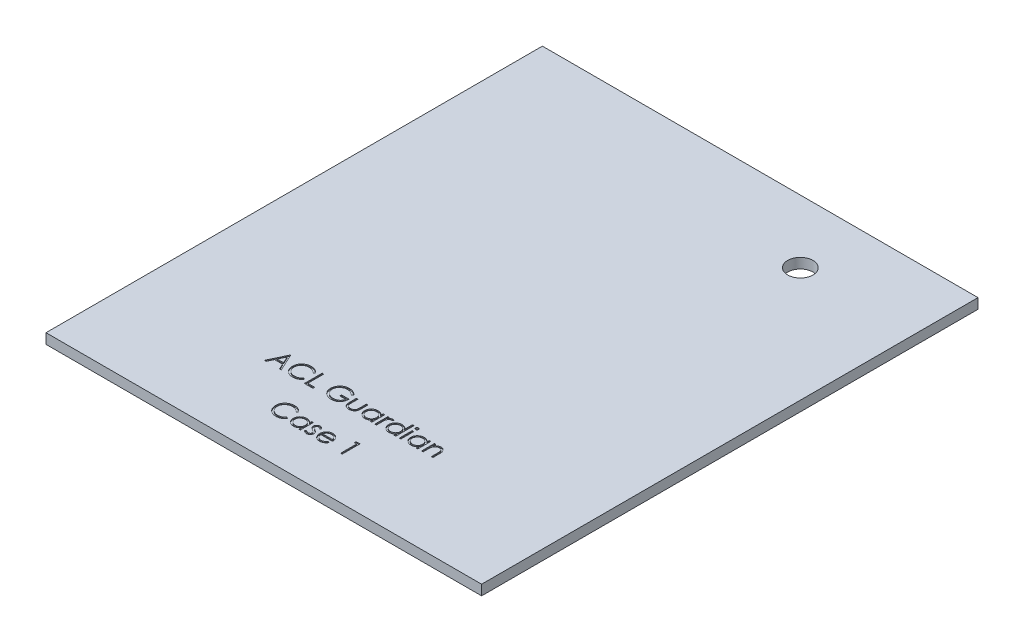
from build123d import *

# Parameters (mm, degrees)
SKETCH1_W           = 86
SKETCH1_H           = 2
BOSS_EXTRUDE1_DEPTH = 98
SKETCH2_R           = 2.5
CUT_EXTRUDE1_DEPTH  = 98
SKETCH3_W           = 0.314102564
SKETCH3_H           = 2.557692308
CUT_EXTRUDE2_DEPTH  = 0.2


with BuildPart() as part:
    # Sketch1 → Boss-Extrude1 (new body)
    with BuildSketch(Plane.XY):
        with Locations((43, -1)):
            Rectangle(SKETCH1_W, SKETCH1_H)
    extrude(amount=BOSS_EXTRUDE1_DEPTH)

    # Sketch2 → Cut-Extrude1 (cut)
    with BuildSketch(Plane(origin=(0, 0, 0), x_dir=(1, 0, 0), z_dir=(0, 1, 0))):
        with Locations(Location((63.346319972, -12.421838095, 0), (0, 0, 270))):
            Circle(SKETCH2_R)
    extrude(amount=-CUT_EXTRUDE1_DEPTH, mode=Mode.SUBTRACT)

    # Sketch3 → Cut-Extrude2 (cut)
    # profile 1 of 17: a face of its own
    with BuildSketch(Plane(origin=(0, 0, 0), x_dir=(1, 0, 0), z_dir=(0, 1, 0))):
        Polygon((27.990384615, -77.660758434), (29.605769231, -81.160758434), (29.264322917, -81.160758434), (28.746895032, -80.038963562), (27.16025641, -80.038963562), (26.62880609, -81.160758434), (26.28525641, -81.160758434), (27.945512821, -77.660758434), align=None)
        Polygon((27.964443109, -78.343651062), (27.331330128, -79.679989203), (28.581430288, -79.679989203), align=None, mode=Mode.SUBTRACT)
    # profile 2 of 17: a face of its own
    with BuildSketch(Plane(origin=(0, 0, 0), x_dir=(1, 0, 0), z_dir=(0, 1, 0))):
        with BuildLine():
            Line((33.46474359, -78.302985998), (33.189903846, -78.513322537))
            add(Edge.make_bspline(
                [(33.189903846, -78.513322537), (33.170297958, -78.489956567), (33.131350511, -78.443539651), (33.068691308, -78.378360107), (33.003389666, -78.317294845), (32.935470544, -78.260052966), (32.863711425, -78.2086362), (32.789850626, -78.160365097), (32.712652581, -78.117097359), (32.605900846, -78.064634373), (32.466252998, -78.009888218), (32.290458159, -77.963984987), (32.10694706, -77.934763811), (31.981749461, -77.931598969), (31.91806891, -77.929989203)],
                knots=[0, 0, 0, 0, 0.757959112, 1.505699292, 2.245454638, 2.979532153, 3.711538275, 4.438200793, 5.171680507, 5.909471876, 7.393775596, 8.890124382, 10.418191784, 12, 12, 12, 12], degree=3))
            add(Edge.make_bspline(
                [(31.91806891, -77.929989203), (31.882985611, -77.930393166), (31.813144618, -77.931197342), (31.709496145, -77.941806467), (31.607783094, -77.956717677), (31.508071627, -77.978843), (31.410488669, -78.006815619), (31.314396267, -78.040241033), (31.221185667, -78.081595873), (31.129567429, -78.127304133), (31.041788218, -78.178931578), (30.95873317, -78.23524493), (30.880705202, -78.295614026), (30.80764259, -78.360265132), (30.739470642, -78.428907093), (30.676683331, -78.502271435), (30.619497921, -78.580123608), (30.566780896, -78.661437016), (30.519568162, -78.745974807), (30.480038283, -78.834049878), (30.445033161, -78.924153981), (30.417333918, -79.017305142), (30.395409401, -79.112847907), (30.380281738, -79.211038695), (30.369793267, -79.311672375), (30.36899309, -79.379881688), (30.368589744, -79.414264043)],
                knots=[0, 0, 0, 0, 1.054917814, 2.100044995, 3.131103042, 4.146048494, 5.169673617, 6.183595914, 7.203665975, 8.234915748, 9.262203917, 10.264457458, 11.251630812, 12.227803204, 13.197192746, 14.159520551, 15.12972552, 16.100847026, 17.073214652, 18.039054194, 19.002613845, 19.979014051, 20.95965708, 21.949030935, 22.966165397, 24, 24, 24, 24], degree=3))
            add(Edge.make_bspline(
                [(30.368589744, -79.414264043), (30.369851563, -79.465995363), (30.372328977, -79.567562948), (30.394377311, -79.716333558), (30.427882402, -79.858854232), (30.478097979, -79.994234075), (30.54001703, -80.124142433), (30.618257641, -80.246381286), (30.708874179, -80.36279785), (30.813148598, -80.470640798), (30.927554414, -80.569154524), (31.050302326, -80.655905105), (31.181086613, -80.728219988), (31.318463244, -80.788395934), (31.463489358, -80.834652662), (31.61590416, -80.867216785), (31.775376155, -80.888458966), (31.884345555, -80.890492654), (31.939803686, -80.891527665)],
                knots=[0, 0, 0, 0, 1.029171465, 2.020641659, 2.987623507, 3.938342917, 4.889210282, 5.84687017, 6.821220943, 7.821438502, 8.827599549, 9.822697543, 10.807740252, 11.797342354, 12.80366471, 13.83203677, 14.896651826, 16, 16, 16, 16], degree=3))
            add(Edge.make_bspline(
                [(31.939803686, -80.891527665), (32.000906375, -80.889838885), (32.121171084, -80.886514963), (32.29753911, -80.858355713), (32.466374876, -80.812697796), (32.627687462, -80.748799873), (32.781022109, -80.665734585), (32.926618769, -80.565036708), (33.064600339, -80.445748375), (33.147571622, -80.354665247), (33.189903846, -80.308194332)],
                knots=[0, 0, 0, 0, 1.028121516, 2.023589091, 2.998037872, 3.967518031, 4.937445131, 5.927275754, 6.942489185, 8, 8, 8, 8], degree=3))
            Line((33.189903846, -80.308194332), (33.46474359, -80.516427505))
            add(Edge.make_bspline(
                [(33.46474359, -80.516427505), (33.44262548, -80.544965957), (33.398495205, -80.601906163), (33.327037188, -80.682177873), (33.25175989, -80.757681908), (33.17210418, -80.827809529), (33.088986389, -80.893963995), (33.000914076, -80.954265826), (32.909045044, -81.00955671), (32.813690565, -81.060183635), (32.714951952, -81.105100882), (32.612947517, -81.14355465), (32.508116942, -81.176679539), (32.400455433, -81.203931476), (32.289739676, -81.22520256), (32.176369202, -81.239422235), (32.060099327, -81.249164149), (31.981657906, -81.250052065), (31.941907051, -81.250502024)],
                knots=[0, 0, 0, 0, 0.986787822, 1.968848986, 2.935600012, 3.899624008, 4.868462664, 5.837806735, 6.815139263, 7.798259679, 8.787526145, 9.778297419, 10.776456485, 11.791383307, 12.812564526, 13.85620153, 14.913611965, 16, 16, 16, 16], degree=3))
            add(Edge.make_bspline(
                [(31.941907051, -81.250502024), (31.904263384, -81.250240031), (31.829827694, -81.249721973), (31.719928943, -81.241329806), (31.612939362, -81.229880069), (31.509164736, -81.212639938), (31.408038761, -81.192295598), (31.310478176, -81.165024341), (31.215522966, -81.134475175), (31.123554625, -81.098570188), (31.034494925, -81.058054006), (30.948631114, -81.012262447), (30.866002682, -80.961580582), (30.785797261, -80.907125572), (30.709199677, -80.84714827), (30.635546152, -80.782481635), (30.564423676, -80.713343624), (30.520420991, -80.663488771), (30.498297276, -80.638422697)],
                knots=[0, 0, 0, 0, 1.114604814, 2.203992996, 3.262667896, 4.300477797, 5.318619304, 6.316056647, 7.298880507, 8.271930387, 9.238335007, 10.195173496, 11.151986948, 12.108099108, 13.064862484, 14.031167946, 15.010108607, 16, 16, 16, 16], degree=3))
            add(Edge.make_bspline(
                [(30.498297276, -80.638422697), (30.462861632, -80.594881508), (30.392418155, -80.508324798), (30.302292472, -80.368038816), (30.225144917, -80.221570608), (30.162768996, -80.068150679), (30.114006263, -79.908123291), (30.080225068, -79.741407777), (30.058273463, -79.568159835), (30.055763174, -79.450323046), (30.054487179, -79.390425902)],
                knots=[0, 0, 0, 0, 0.994628077, 1.977248131, 2.950237994, 3.925870899, 4.908910175, 5.911660606, 6.938484602, 8, 8, 8, 8], degree=3))
            add(Edge.make_bspline(
                [(30.054487179, -79.390425902), (30.056042373, -79.327470449), (30.059102119, -79.203609524), (30.085097915, -79.021835571), (30.126916711, -78.847684172), (30.1863136, -78.681480427), (30.261618951, -78.522350147), (30.354645565, -78.371508942), (30.464312707, -78.227992143), (30.589760275, -78.093977391), (30.72732761, -77.971438039), (30.874646424, -77.863631835), (31.031428371, -77.773914319), (31.195946222, -77.698918156), (31.369431904, -77.641273693), (31.551515273, -77.600920507), (31.741854188, -77.57580339), (31.871716614, -77.572628182), (31.937700321, -77.571014844)],
                knots=[0, 0, 0, 0, 1.032925535, 2.032216505, 3.007276963, 3.968222605, 4.92396291, 5.891752235, 6.871517503, 7.883894988, 8.900124299, 9.891468569, 10.874487609, 11.85992873, 12.854644235, 13.869047385, 14.917252991, 16, 16, 16, 16], degree=3))
            add(Edge.make_bspline(
                [(31.937700321, -77.571014844), (31.977914792, -77.571496983), (32.05751529, -77.572451327), (32.175267942, -77.581757469), (32.289910269, -77.597271075), (32.401521251, -77.618387145), (32.510643867, -77.644594466), (32.616444108, -77.678734765), (32.719542795, -77.717771296), (32.819289703, -77.762729762), (32.915206253, -77.813196503), (33.007262572, -77.868612127), (33.094727431, -77.928907932), (33.178216279, -77.993571108), (33.25633249, -78.063969667), (33.331293969, -78.138167263), (33.400555047, -78.218301087), (33.443308242, -78.274706021), (33.46474359, -78.302985998)],
                knots=[0, 0, 0, 0, 1.096760587, 2.17092713, 3.219439832, 4.250915756, 5.268269357, 6.278326846, 7.281116186, 8.274029601, 9.260640565, 10.235837813, 11.203064059, 12.156899882, 13.114053108, 14.069676657, 15.032185724, 16, 16, 16, 16], degree=3))
        make_face()
    # profile 3 of 17: a face of its own
    with BuildSketch(Plane(origin=(0, 0, 0), x_dir=(1, 0, 0), z_dir=(0, 1, 0))):
        Polygon((34.182692308, -77.660758434), (34.496794872, -77.660758434), (34.496794872, -80.801784075), (35.842948718, -80.801784075), (35.842948718, -81.160758434), (34.182692308, -81.160758434), align=None)
    # profile 4 of 17: a face of its own
    with BuildSketch(Plane(origin=(0, 0, 0), x_dir=(1, 0, 0), z_dir=(0, 1, 0))):
        with BuildLine():
            Line((41.048076923, -78.258114203), (40.778846154, -78.513322537))
            add(Edge.make_bspline(
                [(40.778846154, -78.513322537), (40.730127266, -78.467491674), (40.633851219, -78.376922811), (40.476890977, -78.259411816), (40.313127343, -78.158745715), (40.143414846, -78.076839479), (39.971956292, -78.011486719), (39.801027516, -77.964958578), (39.632381814, -77.935286041), (39.520214596, -77.931737672), (39.46494391, -77.929989203)],
                knots=[0, 0, 0, 0, 1.08915593, 2.152340314, 3.188132944, 4.216796309, 5.218260357, 6.173443236, 7.099959455, 8, 8, 8, 8], degree=3))
            add(Edge.make_bspline(
                [(39.46494391, -77.929989203), (39.43102921, -77.930402809), (39.36328777, -77.931228948), (39.262665826, -77.941773164), (39.163099189, -77.956938028), (39.064775814, -77.978879905), (38.967504528, -78.006688965), (38.871623635, -78.041474428), (38.776954281, -78.082029672), (38.6843882, -78.128892146), (38.594647696, -78.180371993), (38.50989086, -78.237420533), (38.429577461, -78.298209323), (38.355217036, -78.364260302), (38.286381849, -78.434975168), (38.221433478, -78.509038474), (38.162656182, -78.588473692), (38.109565017, -78.671819318), (38.062203398, -78.757611508), (38.020394745, -78.845024497), (37.985297657, -78.933768352), (37.957528201, -79.023954429), (37.934617547, -79.114885019), (37.91849994, -79.20718974), (37.909413218, -79.300967425), (37.907841438, -79.363764684), (37.907051282, -79.395333755)],
                knots=[0, 0, 0, 0, 1.02818874, 2.053710826, 3.065248034, 4.081641283, 5.106893873, 6.131558223, 7.173050175, 8.228653731, 9.27666206, 10.308777013, 11.325269123, 12.329503258, 13.32196095, 14.316845687, 15.314881793, 16.315733098, 17.311955233, 18.285320748, 19.252783886, 20.203351036, 21.145449891, 22.095197417, 23.042428769, 24, 24, 24, 24], degree=3))
            add(Edge.make_bspline(
                [(37.907051282, -79.395333755), (37.907807, -79.427604572), (37.909316373, -79.492058085), (37.918976693, -79.588252158), (37.936904933, -79.68301756), (37.960872642, -79.776665694), (37.990853458, -79.869356941), (38.028226124, -79.960689451), (38.072491724, -80.050659843), (38.123728276, -80.138457459), (38.17991448, -80.223980483), (38.242857561, -80.304540005), (38.309718144, -80.381208782), (38.382932044, -80.452284546), (38.460151586, -80.519668442), (38.543683862, -80.581503964), (38.631886323, -80.638982187), (38.724893535, -80.691378706), (38.821696317, -80.738187242), (38.92095307, -80.779811138), (39.022980886, -80.814090476), (39.127243576, -80.84202858), (39.233616847, -80.864928877), (39.34264065, -80.879661357), (39.453513358, -80.890352188), (39.52825199, -80.891133858), (39.565905449, -80.891527665)],
                knots=[0, 0, 0, 0, 0.93586088, 1.869166235, 2.799637598, 3.729985548, 4.670839027, 5.622275134, 6.589130586, 7.576015415, 8.568469353, 9.55398029, 10.53834874, 11.515998671, 12.510579167, 13.508179873, 14.527009472, 15.561807829, 16.601455013, 17.643573243, 18.680854198, 19.719860599, 20.772568776, 21.833555941, 22.908541556, 24, 24, 24, 24], degree=3))
            add(Edge.make_bspline(
                [(39.565905449, -80.891527665), (39.611283796, -80.890579089), (39.700391553, -80.888716405), (39.831377996, -80.874216116), (39.957181067, -80.851569322), (40.07744727, -80.818403425), (40.192316291, -80.77609975), (40.302209232, -80.725104364), (40.406260891, -80.663461305), (40.504784064, -80.593887438), (40.59554125, -80.516372605), (40.677395374, -80.43272815), (40.749040863, -80.343360083), (40.811545562, -80.248794768), (40.863254217, -80.148249463), (40.905697012, -80.0422169), (40.938230303, -79.930649389), (40.951585278, -79.853557757), (40.958333333, -79.814604588)],
                knots=[0, 0, 0, 0, 1.13008108, 2.219097802, 3.278683437, 4.311054135, 5.322181354, 6.324827112, 7.324222904, 8.330512327, 9.32562643, 10.293043162, 11.24128371, 12.174520618, 13.111833804, 14.052305215, 15.015860969, 16, 16, 16, 16], degree=3))
            Line((40.958333333, -79.814604588), (39.791666667, -79.814604588))
            Line((39.791666667, -79.814604588), (39.791666667, -79.455630229))
            Line((39.791666667, -79.455630229), (41.272435897, -79.455630229))
            add(Edge.make_bspline(
                [(41.272435897, -79.455630229), (41.270730049, -79.522537718), (41.267391396, -79.65348776), (41.24397248, -79.84445803), (41.206155968, -80.024829724), (41.154495656, -80.194792795), (41.087620376, -80.354106388), (41.006247847, -80.502932254), (40.909075726, -80.640308935), (40.799565285, -80.767357939), (40.676665327, -80.880687151), (40.543696707, -80.980293089), (40.400439738, -81.064195704), (40.247029931, -81.132456367), (40.083969497, -81.185730362), (39.910881118, -81.223501938), (39.727999517, -81.246131902), (39.60266284, -81.249023281), (39.538561699, -81.250502024)],
                knots=[0, 0, 0, 0, 1.140356446, 2.231883559, 3.274166699, 4.278491846, 5.25512956, 6.21435461, 7.1637429, 8.11826594, 9.068280886, 10.0076534, 10.945064095, 11.891975133, 12.864533718, 13.863980011, 14.907571808, 16, 16, 16, 16], degree=3))
            add(Edge.make_bspline(
                [(39.538561699, -81.250502024), (39.499051563, -81.249932903), (39.421124843, -81.248810412), (39.306033914, -81.240833065), (39.194116294, -81.228552488), (39.085388285, -81.210007365), (38.979449943, -81.187292711), (38.876830358, -81.158205992), (38.777138616, -81.124537293), (38.68022063, -81.086241619), (38.586956083, -81.041869963), (38.496929566, -80.992560323), (38.409643441, -80.938566962), (38.325692276, -80.878956117), (38.244638654, -80.814173656), (38.167005211, -80.744089737), (38.092357333, -80.668918618), (38.045596869, -80.615539608), (38.022035256, -80.58864305)],
                knots=[0, 0, 0, 0, 1.107784379, 2.184907829, 3.233506516, 4.263428166, 5.276301166, 6.270063455, 7.25232949, 8.225834625, 9.190232166, 10.146266622, 11.1027726, 12.066435141, 13.031522626, 14.010570082, 14.99756817, 16, 16, 16, 16], degree=3))
            add(Edge.make_bspline(
                [(38.022035256, -80.58864305), (37.987849324, -80.545972397), (37.920044912, -80.461339379), (37.832766755, -80.325739435), (37.758365352, -80.185337575), (37.69799753, -80.039742946), (37.650859444, -79.889091734), (37.617053191, -79.733576442), (37.597245902, -79.572996812), (37.594392365, -79.464331547), (37.592948718, -79.409356191)],
                knots=[0, 0, 0, 0, 1.023165419, 2.029347347, 3.013907458, 3.994755782, 4.975994455, 5.96558838, 6.970761222, 8, 8, 8, 8], degree=3))
            add(Edge.make_bspline(
                [(37.592948718, -79.409356191), (37.593480956, -79.368189938), (37.594538668, -79.28638063), (37.607364184, -79.164923323), (37.625765602, -79.045622631), (37.652812657, -78.928576075), (37.686908921, -78.813705483), (37.729462407, -78.700957519), (37.779007303, -78.590265647), (37.8365928, -78.482391779), (37.900677259, -78.378767366), (37.970227479, -78.279809563), (38.04623108, -78.187320498), (38.127446879, -78.10012885), (38.214843869, -78.019330003), (38.307603293, -77.944175892), (38.405796636, -77.874565706), (38.509732816, -77.811595872), (38.6178605, -77.755032251), (38.729920502, -77.705443039), (38.845878613, -77.664459724), (38.96486609, -77.629685944), (39.087783591, -77.603970804), (39.213739128, -77.585322058), (39.34338924, -77.572561459), (39.431025269, -77.571535203), (39.475460737, -77.571014844)],
                knots=[0, 0, 0, 0, 1.008945113, 2.00506715, 2.99143336, 3.967273523, 4.948097931, 5.927297278, 6.919902385, 7.919676788, 8.923139349, 9.905703106, 10.883022732, 11.856032218, 12.825136022, 13.798837087, 14.781400844, 15.773989409, 16.776158564, 17.77167057, 18.775803737, 19.789618931, 20.80898985, 21.851988756, 22.910860228, 24, 24, 24, 24], degree=3))
            add(Edge.make_bspline(
                [(39.475460737, -77.571014844), (39.511698981, -77.571594336), (39.58355516, -77.5727434), (39.690480892, -77.580708048), (39.795753907, -77.593331929), (39.899530296, -77.610558716), (40.001456663, -77.634022406), (40.101823368, -77.662100691), (40.200775904, -77.694792514), (40.298004153, -77.73378136), (40.39416187, -77.778034985), (40.48978371, -77.827848407), (40.584542956, -77.884073412), (40.678603937, -77.946876948), (40.772559795, -78.015180365), (40.864924438, -78.090937189), (40.957927382, -78.171159945), (41.017729196, -78.228842129), (41.048076923, -78.258114203)],
                knots=[0, 0, 0, 0, 0.985871117, 1.954866573, 2.915460327, 3.869826059, 4.81536089, 5.759505086, 6.70452669, 7.649098992, 8.607881297, 9.583363685, 10.581137262, 11.603961102, 12.659522466, 13.73993555, 14.853081303, 16, 16, 16, 16], degree=3))
        make_face()
    # profile 5 of 17: a face of its own
    with BuildSketch(Plane(origin=(0, 0, 0), x_dir=(1, 0, 0), z_dir=(0, 1, 0))):
        with BuildLine():
            Line((41.855769231, -78.603066126), (42.169871795, -78.603066126))
            Line((42.169871795, -78.603066126), (42.169871795, -79.789364203))
            add(Edge.make_bspline(
                [(42.169871795, -79.789364203), (42.1700137, -79.824186953), (42.170285157, -79.890801241), (42.172126098, -79.986656427), (42.176456192, -80.07407314), (42.181870016, -80.153101877), (42.188832152, -80.223729268), (42.197115513, -80.285708625), (42.206373935, -80.339742809), (42.215436648, -80.372286165), (42.219651442, -80.387421094)],
                knots=[0, 0, 0, 0, 1.388932606, 2.656963016, 3.823490214, 4.879454478, 5.816252168, 6.653371382, 7.373723809, 8, 8, 8, 8], degree=3))
            add(Edge.make_bspline(
                [(42.219651442, -80.387421094), (42.226412897, -80.406443965), (42.239795238, -80.444094226), (42.264068722, -80.498483232), (42.294097059, -80.548858514), (42.326956887, -80.597162587), (42.364856294, -80.641964574), (42.407315765, -80.683188817), (42.452914002, -80.722392909), (42.520669026, -80.768777701), (42.613328292, -80.818493031), (42.734981047, -80.861388849), (42.866885273, -80.887024669), (42.958049992, -80.889998924), (43.004907853, -80.891527665)],
                knots=[0, 0, 0, 0, 0.725840625, 1.436591201, 2.137033971, 2.831655856, 3.53531722, 4.242432219, 4.957935707, 5.694543706, 7.190802206, 8.724350549, 10.316345118, 12, 12, 12, 12], degree=3))
            add(Edge.make_bspline(
                [(43.004907853, -80.891527665), (43.05176136, -80.889966416), (43.142414229, -80.886945689), (43.272869198, -80.862162151), (43.392120612, -80.820756462), (43.498971564, -80.76294905), (43.592937404, -80.692206987), (43.671241823, -80.609198178), (43.735849077, -80.516548791), (43.764058498, -80.447424512), (43.778245192, -80.412661479)],
                knots=[0, 0, 0, 0, 1.157059328, 2.238695713, 3.266970494, 4.264342957, 5.228770407, 6.160125903, 7.074715775, 8, 8, 8, 8], degree=3))
            add(Edge.make_bspline(
                [(43.778245192, -80.412661479), (43.782439422, -80.39869518), (43.791711841, -80.367819105), (43.801674192, -80.315439357), (43.810648654, -80.252974752), (43.81831183, -80.180016543), (43.823776993, -80.096755391), (43.826723019, -80.003217315), (43.830051294, -79.899695955), (43.830101811, -79.827228195), (43.830128205, -79.789364203)],
                knots=[0, 0, 0, 0, 0.557542046, 1.232589297, 2.036731608, 2.971723315, 4.038036528, 5.22795436, 6.551621927, 8, 8, 8, 8], degree=3))
            Line((43.830128205, -79.789364203), (43.830128205, -78.603066126))
            Line((43.830128205, -78.603066126), (44.144230769, -78.603066126))
            Line((44.144230769, -78.603066126), (44.144230769, -79.848258434))
            add(Edge.make_bspline(
                [(44.144230769, -79.848258434), (44.143789074, -79.890565606), (44.142932126, -79.972647305), (44.137424783, -80.091931417), (44.12797517, -80.203093662), (44.113632485, -80.306192882), (44.09676681, -80.401150363), (44.075010537, -80.488087809), (44.0490323, -80.566737363), (44.019726785, -80.63847914), (43.985104917, -80.703526034), (43.948277897, -80.765261851), (43.905753125, -80.822154786), (43.86098289, -80.877036923), (43.811181235, -80.927178451), (43.757281376, -80.973729927), (43.700041956, -81.017402959), (43.638192758, -81.056494238), (43.572636695, -81.091710883), (43.503292838, -81.122926961), (43.42931184, -81.147629538), (43.351648203, -81.168940204), (43.269921423, -81.185654673), (43.18421029, -81.19744124), (43.094543674, -81.204666571), (43.033434214, -81.205303616), (43.002103365, -81.205630229)],
                knots=[0, 0, 0, 0, 1.493040784, 2.896703357, 4.213163133, 5.428574705, 6.569057535, 7.615249723, 8.588095153, 9.490268104, 10.346124644, 11.18633936, 12.024365274, 12.850166724, 13.684164916, 14.514361689, 15.362232829, 16.222528818, 17.093394965, 17.986930858, 18.902426812, 19.842810585, 20.827885679, 21.843828298, 22.894529745, 24, 24, 24, 24], degree=3))
            add(Edge.make_bspline(
                [(43.002103365, -81.205630229), (42.971006851, -81.205290522), (42.909899306, -81.204622966), (42.820228062, -81.197481158), (42.734279456, -81.185672987), (42.652359057, -81.16881777), (42.57438466, -81.1477787), (42.50004042, -81.122775165), (42.430196857, -81.091694683), (42.364014853, -81.056717125), (42.302012465, -81.01715185), (42.243903887, -80.97378381), (42.189767034, -80.926677747), (42.139589966, -80.87603039), (42.09407699, -80.821213454), (42.052660948, -80.762667893), (42.014704243, -80.700973805), (41.980351452, -80.634910642), (41.950839697, -80.562338633), (41.924784451, -80.482041536), (41.903473812, -80.393139019), (41.886131344, -80.29570709), (41.872179904, -80.190212049), (41.862493761, -80.076043633), (41.857077931, -79.953479941), (41.856214869, -79.868830051), (41.855769231, -79.825121415)],
                knots=[0, 0, 0, 0, 1.083640291, 2.129454052, 3.13281866, 4.105697902, 5.042300162, 5.946461698, 6.836384745, 7.703652036, 8.553297018, 9.397182691, 10.228592656, 11.052265423, 11.879314572, 12.708807002, 13.549817954, 14.402308542, 15.300838682, 16.27712199, 17.341985831, 18.484375296, 19.725102775, 21.0496083, 22.476576903, 24, 24, 24, 24], degree=3))
            Line((41.855769231, -79.825121415), (41.855769231, -78.603066126))
        make_face()
    # profile 6 of 17: a face of its own
    with BuildSketch(Plane(origin=(0, 0, 0), x_dir=(1, 0, 0), z_dir=(0, 1, 0))):
        with BuildLine():
            Line((47.46474359, -78.603066126), (47.46474359, -81.160758434))
            Line((47.46474359, -81.160758434), (47.150641026, -81.160758434))
            Line((47.150641026, -81.160758434), (47.150641026, -80.718350582))
            add(Edge.make_bspline(
                [(47.150641026, -80.718350582), (47.115222235, -80.758390176), (47.04610202, -80.836527947), (46.930660902, -80.938610119), (46.808292724, -81.022988441), (46.679591403, -81.091138356), (46.544673159, -81.142330413), (46.403837072, -81.178716572), (46.257025691, -81.202110407), (46.156773336, -81.204446429), (46.105969551, -81.205630229)],
                knots=[0, 0, 0, 0, 1.074387032, 2.096679803, 3.090159297, 4.057316773, 5.018401886, 5.985159533, 6.978961417, 8, 8, 8, 8], degree=3))
            add(Edge.make_bspline(
                [(46.105969551, -81.205630229), (46.060801597, -81.204403857), (45.971728393, -81.201985396), (45.840699315, -81.183223093), (45.714607066, -81.153092471), (45.593332493, -81.111191582), (45.477660348, -81.05561076), (45.366600251, -80.989069512), (45.260727559, -80.909828682), (45.16165602, -80.819240653), (45.07042402, -80.720845666), (44.990362747, -80.615900119), (44.923609667, -80.504857816), (44.867789587, -80.389124662), (44.824793242, -80.267809742), (44.794819608, -80.141332574), (44.776079161, -80.009842701), (44.773661701, -79.920303178), (44.772435897, -79.874901062)],
                knots=[0, 0, 0, 0, 1.033919861, 2.038935746, 3.024066025, 3.998881131, 4.97069526, 5.957263378, 6.95902576, 7.993208707, 9.027059324, 10.027763471, 11.009749337, 11.988697705, 12.965288445, 13.950418724, 14.960734635, 16, 16, 16, 16], degree=3))
            add(Edge.make_bspline(
                [(44.772435897, -79.874901062), (44.773688869, -79.830437359), (44.776165926, -79.742535015), (44.794619145, -79.613256317), (44.825650154, -79.488738057), (44.869198002, -79.369381114), (44.925039957, -79.255041063), (44.992968044, -79.145637038), (45.072987169, -79.040867641), (45.165239576, -78.943196414), (45.265174346, -78.8529758), (45.372083077, -78.774566754), (45.483306358, -78.706849906), (45.600569368, -78.653196429), (45.722136473, -78.609787325), (45.849089919, -78.579754357), (45.980901498, -78.562057035), (46.07039199, -78.559494271), (46.115785256, -78.558194332)],
                knots=[0, 0, 0, 0, 1.020392517, 2.01726096, 2.990465484, 3.961182959, 4.928053699, 5.906110375, 6.912531644, 7.948652711, 8.985773172, 9.998621852, 10.987621588, 11.969261332, 12.953316658, 13.946091881, 14.958173133, 16, 16, 16, 16], degree=3))
            add(Edge.make_bspline(
                [(46.115785256, -78.558194332), (46.167985115, -78.559632083), (46.270346575, -78.562451446), (46.420074585, -78.585914173), (46.561719063, -78.625552641), (46.696373415, -78.679470139), (46.823554101, -78.751118868), (46.942057085, -78.841498829), (47.053122568, -78.950040016), (47.11750286, -79.03341046), (47.150641026, -79.076323338)],
                knots=[0, 0, 0, 0, 1.038897134, 2.037228247, 3.008116434, 3.962042015, 4.918381754, 5.904844433, 6.921570401, 8, 8, 8, 8], degree=3))
            Line((47.150641026, -79.076323338), (47.150641026, -78.603066126))
            Line((47.150641026, -78.603066126), (47.46474359, -78.603066126))
        make_face()
        with BuildLine():
            add(Edge.make_bspline(
                [(46.119991987, -78.872296896), (46.074077649, -78.873930533), (45.983450049, -78.877155074), (45.850406047, -78.90232857), (45.723092633, -78.944213164), (45.602146559, -79.001495065), (45.489478342, -79.073523802), (45.388784671, -79.160645185), (45.29924197, -79.260482199), (45.223933706, -79.37258431), (45.162543209, -79.492762401), (45.119376177, -79.618386839), (45.09090693, -79.747191816), (45.087998409, -79.834554502), (45.086538462, -79.878406671)],
                knots=[0, 0, 0, 0, 1.031046209, 2.035121221, 3.029706178, 4.034933723, 5.034054252, 6.02443088, 7.017295772, 8.038157696, 9.050218397, 10.03989886, 11.016116709, 12, 12, 12, 12], degree=3))
            add(Edge.make_bspline(
                [(45.086538462, -79.878406671), (45.088403355, -79.921996779), (45.092125832, -80.009006134), (45.118876526, -80.137986711), (45.1637564, -80.263640753), (45.224998462, -80.384901747), (45.301685087, -80.497485847), (45.39057374, -80.59922597), (45.492524021, -80.686715558), (45.605451528, -80.759953132), (45.726059498, -80.819115652), (45.85289343, -80.860281292), (45.983569068, -80.886859073), (46.072421402, -80.889963549), (46.1171875, -80.891527665)],
                knots=[0, 0, 0, 0, 0.979072187, 1.954306742, 2.945804271, 3.96968567, 4.997920485, 5.998718438, 6.996577872, 8.005894225, 9.015743152, 10.005417472, 10.995077863, 12, 12, 12, 12], degree=3))
            add(Edge.make_bspline(
                [(46.1171875, -80.891527665), (46.162634003, -80.889867701), (46.253022589, -80.886566197), (46.386461297, -80.861284932), (46.51595626, -80.819516134), (46.639743488, -80.761617007), (46.755059619, -80.689859651), (46.858557497, -80.60585256), (46.946073465, -80.508149376), (47.020266075, -80.400772923), (47.078441492, -80.283060926), (47.120817551, -80.157726736), (47.145871457, -80.024765988), (47.149029186, -79.933902061), (47.150641026, -79.887521255)],
                knots=[0, 0, 0, 0, 1.01762866, 2.023962475, 3.030623092, 4.058876274, 5.077231937, 6.066672613, 7.034107872, 8.005628644, 8.981990164, 9.965428785, 10.961468474, 12, 12, 12, 12], degree=3))
            add(Edge.make_bspline(
                [(47.150641026, -79.887521255), (47.149681369, -79.852183424), (47.147792462, -79.782627391), (47.133361892, -79.680499873), (47.110406966, -79.582766147), (47.078060796, -79.489323458), (47.035569511, -79.400688443), (46.984321746, -79.316224683), (46.923416296, -79.236371471), (46.8538336, -79.1622284), (46.777668397, -79.094601938), (46.697073857, -79.034237697), (46.61109511, -78.984648924), (46.521178073, -78.943607653), (46.427166738, -78.910948503), (46.328296118, -78.889160809), (46.225617131, -78.874200488), (46.155571076, -78.872938107), (46.119991987, -78.872296896)],
                knots=[0, 0, 0, 0, 1.050140795, 2.067009409, 3.05949893, 4.030605086, 5.00011959, 5.97591094, 6.962425594, 7.979863591, 8.993523472, 9.986985069, 10.967611495, 11.937549037, 12.921786183, 13.919465291, 14.943216303, 16, 16, 16, 16], degree=3))
        make_face(mode=Mode.SUBTRACT)
    # profile 7 of 17: a face of its own
    with BuildSketch(Plane(origin=(0, 0, 0), x_dir=(1, 0, 0), z_dir=(0, 1, 0))):
        with BuildLine():
            Line((48.092948718, -78.603066126), (48.407051282, -78.603066126))
            Line((48.407051282, -78.603066126), (48.407051282, -78.97956853))
            add(Edge.make_bspline(
                [(48.407051282, -78.97956853), (48.430240041, -78.944512702), (48.474588362, -78.877468703), (48.548301291, -78.788799402), (48.623804622, -78.715384355), (48.70145981, -78.656880836), (48.78183791, -78.613067717), (48.863174861, -78.580974682), (48.946750331, -78.561997367), (49.002912255, -78.559463708), (49.031049679, -78.558194332)],
                knots=[0, 0, 0, 0, 1.2804753, 2.448899062, 3.506932113, 4.484331642, 5.4025378, 6.288909075, 7.142734305, 8, 8, 8, 8], degree=3))
            add(Edge.make_bspline(
                [(49.031049679, -78.558194332), (49.052876006, -78.559384858), (49.097785091, -78.561834444), (49.165767681, -78.579045269), (49.235811133, -78.606523291), (49.28095352, -78.632363514), (49.304487179, -78.645834556)],
                knots=[0, 0, 0, 0, 0.901110191, 1.854092781, 2.881294221, 4, 4, 4, 4], degree=3))
            Line((49.304487179, -78.645834556), (49.132011218, -78.917869812))
            add(Edge.make_bspline(
                [(49.132011218, -78.917869812), (49.116902197, -78.911129546), (49.088222382, -78.898335231), (49.046267816, -78.883193221), (49.007586479, -78.874277305), (48.982942921, -78.872926587), (48.971454327, -78.872296896)],
                knots=[0, 0, 0, 0, 1.180555205, 2.24091978, 3.179933427, 4, 4, 4, 4], degree=3))
            add(Edge.make_bspline(
                [(48.971454327, -78.872296896), (48.946248593, -78.873976933), (48.894836203, -78.877403722), (48.819351704, -78.90434253), (48.746104499, -78.94786777), (48.687932836, -78.996138882), (48.642890583, -79.042686679), (48.610750358, -79.083335082), (48.581267611, -79.128913714), (48.55309739, -79.178643397), (48.527431096, -79.233373243), (48.503476427, -79.292556457), (48.481817564, -79.356261586), (48.46946732, -79.400644106), (48.463141026, -79.423378626)],
                knots=[0, 0, 0, 0, 1.125678352, 2.296057538, 3.5422874, 4.923748041, 5.663163013, 6.437101912, 7.23742474, 8.08941207, 8.991984279, 9.93940061, 10.944477711, 12, 12, 12, 12], degree=3))
            add(Edge.make_bspline(
                [(48.463141026, -79.423378626), (48.458408632, -79.4436558), (48.447926741, -79.488568199), (48.437735203, -79.563916723), (48.427665685, -79.652940382), (48.420569066, -79.755886975), (48.413991024, -79.872499419), (48.410280942, -80.002955365), (48.407177801, -80.147388716), (48.407094735, -80.248363069), (48.407051282, -80.301183114)],
                knots=[0, 0, 0, 0, 0.566838948, 1.255505196, 2.06880316, 3.007127437, 4.065329342, 5.249902469, 6.561414163, 8, 8, 8, 8], degree=3))
            Line((48.407051282, -80.301183114), (48.407051282, -81.160758434))
            Line((48.407051282, -81.160758434), (48.092948718, -81.160758434))
            Line((48.092948718, -81.160758434), (48.092948718, -78.603066126))
        make_face()
    # profile 8 of 17: a face of its own
    with BuildSketch(Plane(origin=(0, 0, 0), x_dir=(1, 0, 0), z_dir=(0, 1, 0))):
        with BuildLine():
            Line((52.221153846, -77.571014844), (52.221153846, -81.160758434))
            Line((52.221153846, -81.160758434), (51.907051282, -81.160758434))
            Line((51.907051282, -81.160758434), (51.907051282, -80.718350582))
            add(Edge.make_bspline(
                [(51.907051282, -80.718350582), (51.871632491, -80.758390176), (51.802512276, -80.836527947), (51.687071158, -80.938610119), (51.56470298, -81.022988441), (51.436001659, -81.091138356), (51.301083416, -81.142330413), (51.160247329, -81.178716572), (51.013435948, -81.202110407), (50.913183593, -81.204446429), (50.862379808, -81.205630229)],
                knots=[0, 0, 0, 0, 1.074387032, 2.096679803, 3.090159297, 4.057316773, 5.018401886, 5.985159533, 6.978961417, 8, 8, 8, 8], degree=3))
            add(Edge.make_bspline(
                [(50.862379808, -81.205630229), (50.817211854, -81.204403857), (50.728138649, -81.201985396), (50.597109572, -81.183223093), (50.471017322, -81.153092471), (50.34974275, -81.111191582), (50.234070604, -81.05561076), (50.123010508, -80.989069512), (50.017137816, -80.909828682), (49.918066277, -80.819240653), (49.826834276, -80.720845666), (49.746773004, -80.615900119), (49.680019924, -80.504857816), (49.624199843, -80.389124662), (49.581203499, -80.267809742), (49.551229864, -80.141332574), (49.532489418, -80.009842701), (49.530071957, -79.920303178), (49.528846154, -79.874901062)],
                knots=[0, 0, 0, 0, 1.033919861, 2.038935746, 3.024066025, 3.998881131, 4.97069526, 5.957263378, 6.95902576, 7.993208707, 9.027059324, 10.027763471, 11.009749337, 11.988697705, 12.965288445, 13.950418724, 14.960734635, 16, 16, 16, 16], degree=3))
            add(Edge.make_bspline(
                [(49.528846154, -79.874901062), (49.530099125, -79.830437359), (49.532576182, -79.742535015), (49.551029402, -79.613256317), (49.582060411, -79.488738057), (49.625608258, -79.369381114), (49.681450213, -79.255041063), (49.7493783, -79.145637038), (49.829397425, -79.040867641), (49.921649832, -78.943196414), (50.021584602, -78.8529758), (50.128493333, -78.774566754), (50.239716614, -78.706849906), (50.356979625, -78.653196429), (50.47854673, -78.609787325), (50.605500175, -78.579754357), (50.737311754, -78.562057035), (50.826802246, -78.559494271), (50.872195513, -78.558194332)],
                knots=[0, 0, 0, 0, 1.020392517, 2.01726096, 2.990465484, 3.961182959, 4.928053699, 5.906110375, 6.912531644, 7.948652711, 8.985773172, 9.998621852, 10.987621588, 11.969261332, 12.953316658, 13.946091881, 14.958173133, 16, 16, 16, 16], degree=3))
            add(Edge.make_bspline(
                [(50.872195513, -78.558194332), (50.924412321, -78.559761428), (51.026908111, -78.562837463), (51.176806633, -78.58854383), (51.318594243, -78.631706708), (51.453087231, -78.690797989), (51.579483791, -78.76759874), (51.698710432, -78.860350188), (51.808693754, -78.971677334), (51.873765577, -79.055288908), (51.907051282, -79.098058114)],
                knots=[0, 0, 0, 0, 1.031072012, 2.023879775, 2.993683497, 3.952812103, 4.918022106, 5.908088563, 6.929940113, 8, 8, 8, 8], degree=3))
            Line((51.907051282, -79.098058114), (51.907051282, -77.571014844))
            Line((51.907051282, -77.571014844), (52.221153846, -77.571014844))
        make_face()
        with BuildLine():
            add(Edge.make_bspline(
                [(50.876402244, -78.872296896), (50.830487906, -78.873930533), (50.739860306, -78.877155074), (50.606816304, -78.90232857), (50.47950289, -78.944213164), (50.358556815, -79.001495065), (50.245888599, -79.073523802), (50.145194928, -79.160645185), (50.055652227, -79.260482199), (49.980343962, -79.37258431), (49.918953465, -79.492762401), (49.875786433, -79.618386839), (49.847317186, -79.747191816), (49.844408665, -79.834554502), (49.842948718, -79.878406671)],
                knots=[0, 0, 0, 0, 1.031046209, 2.035121221, 3.029706178, 4.034933723, 5.034054252, 6.02443088, 7.017295772, 8.038157696, 9.050218397, 10.03989886, 11.016116709, 12, 12, 12, 12], degree=3))
            add(Edge.make_bspline(
                [(49.842948718, -79.878406671), (49.844813611, -79.921996779), (49.848536088, -80.009006134), (49.875286783, -80.137986711), (49.920166656, -80.263640753), (49.981408719, -80.384901747), (50.058095343, -80.497485847), (50.146983996, -80.59922597), (50.248934277, -80.686715558), (50.361861784, -80.759953132), (50.482469755, -80.819115652), (50.609303686, -80.860281292), (50.739979324, -80.886859073), (50.828831658, -80.889963549), (50.873597756, -80.891527665)],
                knots=[0, 0, 0, 0, 0.979072187, 1.954306742, 2.945804271, 3.96968567, 4.997920485, 5.998718438, 6.996577872, 8.005894225, 9.015743152, 10.005417472, 10.995077863, 12, 12, 12, 12], degree=3))
            add(Edge.make_bspline(
                [(50.873597756, -80.891527665), (50.919044259, -80.889867701), (51.009432846, -80.886566197), (51.142871554, -80.861284932), (51.272366516, -80.819516134), (51.396153745, -80.761617007), (51.511469876, -80.689859651), (51.614967754, -80.60585256), (51.702483722, -80.508149376), (51.776676331, -80.400772923), (51.834851748, -80.283060926), (51.877227807, -80.157726736), (51.902281713, -80.024765988), (51.905439443, -79.933902061), (51.907051282, -79.887521255)],
                knots=[0, 0, 0, 0, 1.01762866, 2.023962475, 3.030623092, 4.058876274, 5.077231937, 6.066672613, 7.034107872, 8.005628644, 8.981990164, 9.965428785, 10.961468474, 12, 12, 12, 12], degree=3))
            add(Edge.make_bspline(
                [(51.907051282, -79.887521255), (51.906091626, -79.852183424), (51.904202718, -79.782627391), (51.889772149, -79.680499873), (51.866817222, -79.582766147), (51.834471052, -79.489323458), (51.791979768, -79.400688443), (51.740732002, -79.316224683), (51.679826552, -79.236371471), (51.610243856, -79.1622284), (51.534078654, -79.094601938), (51.453484113, -79.034237697), (51.367505366, -78.984648924), (51.277588329, -78.943607653), (51.183576995, -78.910948503), (51.084706375, -78.889160809), (50.982027388, -78.874200488), (50.911981332, -78.872938107), (50.876402244, -78.872296896)],
                knots=[0, 0, 0, 0, 1.050140795, 2.067009409, 3.05949893, 4.030605086, 5.00011959, 5.97591094, 6.962425594, 7.979863591, 8.993523472, 9.986985069, 10.967611495, 11.937549037, 12.921786183, 13.919465291, 14.943216303, 16, 16, 16, 16], degree=3))
        make_face(mode=Mode.SUBTRACT)
    # profile 9 of 17: a face of its own
    with BuildSketch(Plane(origin=(0, 0, 0), x_dir=(1, 0, 0), z_dir=(0, 1, 0))):
        with BuildLine():
            add(Edge.make_bspline(
                [(53.049879808, -77.52614305), (53.069371123, -77.527047202), (53.107538863, -77.528817706), (53.162732131, -77.543979183), (53.212989143, -77.569678868), (53.257566876, -77.604158549), (53.295818763, -77.644707993), (53.322599473, -77.691968961), (53.339811869, -77.7430276), (53.341890424, -77.778642689), (53.342948718, -77.796776062)],
                knots=[0, 0, 0, 0, 1.055194115, 2.066272739, 3.074728998, 4.095836921, 5.109056067, 6.073838105, 7.019297344, 8, 8, 8, 8], degree=3))
            add(Edge.make_bspline(
                [(53.342948718, -77.796776062), (53.341866558, -77.814438716), (53.339727256, -77.849355691), (53.322612768, -77.899529163), (53.29559053, -77.946133446), (53.257591404, -77.986604156), (53.212982643, -78.021064776), (53.162733858, -78.046769515), (53.107538409, -78.061929653), (53.06937097, -78.063700341), (53.049879808, -78.064604588)],
                knots=[0, 0, 0, 0, 0.96129708, 1.900370562, 2.859976407, 3.87933698, 4.906634145, 5.921202961, 6.938410037, 8, 8, 8, 8], degree=3))
            add(Edge.make_bspline(
                [(53.049879808, -78.064604588), (53.030611533, -78.063734868), (52.993108352, -78.062042071), (52.93874151, -78.046472053), (52.888913021, -78.02105598), (52.844248348, -77.986829795), (52.807018155, -77.945884898), (52.779919829, -77.899557604), (52.762844868, -77.849348449), (52.760700239, -77.814436283), (52.759615385, -77.796776062)],
                knots=[0, 0, 0, 0, 1.054934014, 2.053291228, 3.073705704, 4.106921865, 5.123545215, 6.088680038, 7.033164197, 8, 8, 8, 8], degree=3))
            add(Edge.make_bspline(
                [(52.759615385, -77.796776062), (52.760676471, -77.778645213), (52.762760512, -77.74303508), (52.779932628, -77.691940047), (52.806792436, -77.644958545), (52.844273, -77.603933046), (52.88890646, -77.569687611), (52.938743205, -77.54427663), (52.993107905, -77.52870529), (53.030611381, -77.527012676), (53.049879808, -77.52614305)],
                knots=[0, 0, 0, 0, 0.98631895, 1.937192651, 2.907499808, 3.917963147, 4.944918757, 5.95915025, 6.951458133, 8, 8, 8, 8], degree=3))
        make_face()
    # profile 10 of 17: a face of its own
    with BuildSketch(Plane(origin=(0, 0, 0), x_dir=(1, 0, 0), z_dir=(0, 1, 0))):
        with Locations((53.051282051, -79.88191228)):
            Rectangle(SKETCH3_W, SKETCH3_H)
    # profile 11 of 17: a face of its own
    with BuildSketch(Plane(origin=(0, 0, 0), x_dir=(1, 0, 0), z_dir=(0, 1, 0))):
        with BuildLine():
            Line((56.573717949, -78.603066126), (56.573717949, -81.160758434))
            Line((56.573717949, -81.160758434), (56.259615385, -81.160758434))
            Line((56.259615385, -81.160758434), (56.259615385, -80.718350582))
            add(Edge.make_bspline(
                [(56.259615385, -80.718350582), (56.224196594, -80.758390176), (56.155076379, -80.836527947), (56.039635261, -80.938610119), (55.917267083, -81.022988441), (55.788565762, -81.091138356), (55.653647518, -81.142330413), (55.512811431, -81.178716572), (55.36600005, -81.202110407), (55.265747695, -81.204446429), (55.21494391, -81.205630229)],
                knots=[0, 0, 0, 0, 1.074387032, 2.096679803, 3.090159297, 4.057316773, 5.018401886, 5.985159533, 6.978961417, 8, 8, 8, 8], degree=3))
            add(Edge.make_bspline(
                [(55.21494391, -81.205630229), (55.169775956, -81.204403857), (55.080702752, -81.201985396), (54.949673674, -81.183223093), (54.823581425, -81.153092471), (54.702306852, -81.111191582), (54.586634707, -81.05561076), (54.47557461, -80.989069512), (54.369701918, -80.909828682), (54.270630379, -80.819240653), (54.179398379, -80.720845666), (54.099337106, -80.615900119), (54.032584026, -80.504857816), (53.976763946, -80.389124662), (53.933767601, -80.267809742), (53.903793967, -80.141332574), (53.88505352, -80.009842701), (53.88263606, -79.920303178), (53.881410256, -79.874901062)],
                knots=[0, 0, 0, 0, 1.033919861, 2.038935746, 3.024066025, 3.998881131, 4.97069526, 5.957263378, 6.95902576, 7.993208707, 9.027059324, 10.027763471, 11.009749337, 11.988697705, 12.965288445, 13.950418724, 14.960734635, 16, 16, 16, 16], degree=3))
            add(Edge.make_bspline(
                [(53.881410256, -79.874901062), (53.882663228, -79.830437359), (53.885140285, -79.742535015), (53.903593504, -79.613256317), (53.934624513, -79.488738057), (53.978172361, -79.369381114), (54.034014316, -79.255041063), (54.101942403, -79.145637038), (54.181961527, -79.040867641), (54.274213934, -78.943196414), (54.374148705, -78.8529758), (54.481057436, -78.774566754), (54.592280717, -78.706849906), (54.709543727, -78.653196429), (54.831110832, -78.609787325), (54.958064278, -78.579754357), (55.089875857, -78.562057035), (55.179366349, -78.559494271), (55.224759615, -78.558194332)],
                knots=[0, 0, 0, 0, 1.020392517, 2.01726096, 2.990465484, 3.961182959, 4.928053699, 5.906110375, 6.912531644, 7.948652711, 8.985773172, 9.998621852, 10.987621588, 11.969261332, 12.953316658, 13.946091881, 14.958173133, 16, 16, 16, 16], degree=3))
            add(Edge.make_bspline(
                [(55.224759615, -78.558194332), (55.276959474, -78.559632083), (55.379320934, -78.562451446), (55.529048944, -78.585914173), (55.670693422, -78.625552641), (55.805347774, -78.679470139), (55.93252846, -78.751118868), (56.051031444, -78.841498829), (56.162096927, -78.950040016), (56.226477219, -79.03341046), (56.259615385, -79.076323338)],
                knots=[0, 0, 0, 0, 1.038897134, 2.037228247, 3.008116434, 3.962042015, 4.918381754, 5.904844433, 6.921570401, 8, 8, 8, 8], degree=3))
            Line((56.259615385, -79.076323338), (56.259615385, -78.603066126))
            Line((56.259615385, -78.603066126), (56.573717949, -78.603066126))
        make_face()
        with BuildLine():
            add(Edge.make_bspline(
                [(55.228966346, -78.872296896), (55.183052008, -78.873930533), (55.092424408, -78.877155074), (54.959380406, -78.90232857), (54.832066992, -78.944213164), (54.711120918, -79.001495065), (54.598452701, -79.073523802), (54.49775903, -79.160645185), (54.408216329, -79.260482199), (54.332908065, -79.37258431), (54.271517568, -79.492762401), (54.228350536, -79.618386839), (54.199881289, -79.747191816), (54.196972768, -79.834554502), (54.195512821, -79.878406671)],
                knots=[0, 0, 0, 0, 1.031046209, 2.035121221, 3.029706178, 4.034933723, 5.034054252, 6.02443088, 7.017295772, 8.038157696, 9.050218397, 10.03989886, 11.016116709, 12, 12, 12, 12], degree=3))
            add(Edge.make_bspline(
                [(54.195512821, -79.878406671), (54.197377714, -79.921996779), (54.201100191, -80.009006134), (54.227850885, -80.137986711), (54.272730759, -80.263640753), (54.333972821, -80.384901747), (54.410659446, -80.497485847), (54.499548099, -80.59922597), (54.60149838, -80.686715558), (54.714425887, -80.759953132), (54.835033857, -80.819115652), (54.961867789, -80.860281292), (55.092543427, -80.886859073), (55.181395761, -80.889963549), (55.226161859, -80.891527665)],
                knots=[0, 0, 0, 0, 0.979072187, 1.954306742, 2.945804271, 3.96968567, 4.997920485, 5.998718438, 6.996577872, 8.005894225, 9.015743152, 10.005417472, 10.995077863, 12, 12, 12, 12], degree=3))
            add(Edge.make_bspline(
                [(55.226161859, -80.891527665), (55.271608362, -80.889867701), (55.361996948, -80.886566197), (55.495435656, -80.861284932), (55.624930619, -80.819516134), (55.748717847, -80.761617007), (55.864033978, -80.689859651), (55.967531856, -80.60585256), (56.055047824, -80.508149376), (56.129240434, -80.400772923), (56.187415851, -80.283060926), (56.22979191, -80.157726736), (56.254845816, -80.024765988), (56.258003545, -79.933902061), (56.259615385, -79.887521255)],
                knots=[0, 0, 0, 0, 1.01762866, 2.023962475, 3.030623092, 4.058876274, 5.077231937, 6.066672613, 7.034107872, 8.005628644, 8.981990164, 9.965428785, 10.961468474, 12, 12, 12, 12], degree=3))
            add(Edge.make_bspline(
                [(56.259615385, -79.887521255), (56.258655728, -79.852183424), (56.256766821, -79.782627391), (56.242336251, -79.680499873), (56.219381325, -79.582766147), (56.187035155, -79.489323458), (56.14454387, -79.400688443), (56.093296105, -79.316224683), (56.032390655, -79.236371471), (55.962807959, -79.1622284), (55.886642756, -79.094601938), (55.806048216, -79.034237697), (55.720069469, -78.984648924), (55.630152432, -78.943607653), (55.536141097, -78.910948503), (55.437270477, -78.889160809), (55.33459149, -78.874200488), (55.264545435, -78.872938107), (55.228966346, -78.872296896)],
                knots=[0, 0, 0, 0, 1.050140795, 2.067009409, 3.05949893, 4.030605086, 5.00011959, 5.97591094, 6.962425594, 7.979863591, 8.993523472, 9.986985069, 10.967611495, 11.937549037, 12.921786183, 13.919465291, 14.943216303, 16, 16, 16, 16], degree=3))
        make_face(mode=Mode.SUBTRACT)
    # profile 12 of 17: a face of its own
    with BuildSketch(Plane(origin=(0, 0, 0), x_dir=(1, 0, 0), z_dir=(0, 1, 0))):
        with BuildLine():
            Line((57.291666667, -78.603066126), (57.605769231, -78.603066126))
            Line((57.605769231, -78.603066126), (57.605769231, -79.064404267))
            add(Edge.make_bspline(
                [(57.605769231, -79.064404267), (57.639306866, -79.022561545), (57.704387817, -78.941364281), (57.81277215, -78.834643707), (57.927316051, -78.746698482), (58.047318054, -78.676594688), (58.172941064, -78.623748061), (58.303419334, -78.58558213), (58.43953404, -78.562697302), (58.532098477, -78.559707072), (58.578926282, -78.558194332)],
                knots=[0, 0, 0, 0, 1.12780773, 2.188550248, 3.19190651, 4.159438251, 5.104880172, 6.052711206, 7.014878035, 8, 8, 8, 8], degree=3))
            add(Edge.make_bspline(
                [(58.578926282, -78.558194332), (58.626256916, -78.559939527), (58.718894384, -78.563355295), (58.853772445, -78.590371987), (58.979745839, -78.636517242), (59.096365395, -78.699729312), (59.201492608, -78.778335786), (59.29381746, -78.869913567), (59.370180707, -78.97524965), (59.42137807, -79.072972807), (59.455103718, -79.159661601), (59.476336055, -79.233908351), (59.494367037, -79.316626502), (59.509998785, -79.407566091), (59.520575897, -79.507364282), (59.528918188, -79.615611974), (59.534896882, -79.732274104), (59.535134089, -79.812960732), (59.53525641, -79.85456853)],
                knots=[0, 0, 0, 0, 1.235846778, 2.418850247, 3.575807741, 4.728682307, 5.871620074, 6.994088408, 8.11269785, 9.256955736, 9.865816715, 10.540099792, 11.271859618, 12.076849838, 12.949306005, 13.892391288, 14.913166135, 16, 16, 16, 16], degree=3))
            Line((59.53525641, -79.85456853), (59.53525641, -81.160758434))
            Line((59.53525641, -81.160758434), (59.221153846, -81.160758434))
            Line((59.221153846, -81.160758434), (59.221153846, -79.957633434))
            add(Edge.make_bspline(
                [(59.221153846, -79.957633434), (59.220960638, -79.922810989), (59.220591064, -79.856201578), (59.219425417, -79.760832555), (59.216615611, -79.674345977), (59.212667298, -79.596948609), (59.206888267, -79.528714773), (59.200865636, -79.469505496), (59.193500659, -79.419395954), (59.186937746, -79.389230871), (59.183994391, -79.375702344)],
                knots=[0, 0, 0, 0, 1.430800155, 2.736877192, 3.918605307, 4.986035426, 5.920637409, 6.731861385, 7.431261377, 8, 8, 8, 8], degree=3))
            add(Edge.make_bspline(
                [(59.183994391, -79.375702344), (59.17336886, -79.335991159), (59.152917999, -79.259559415), (59.102384016, -79.155885062), (59.038569835, -79.067686874), (58.960671986, -78.995510153), (58.86944291, -78.939339316), (58.765135767, -78.900365361), (58.648757126, -78.875989092), (58.566902744, -78.87356196), (58.524238782, -78.872296896)],
                knots=[0, 0, 0, 0, 1.084156227, 2.086665306, 3.027808233, 3.945421172, 4.874247719, 5.839848303, 6.874090471, 8, 8, 8, 8], degree=3))
            add(Edge.make_bspline(
                [(58.524238782, -78.872296896), (58.498971098, -78.8727729), (58.448967005, -78.873714901), (58.374817034, -78.883166199), (58.30289286, -78.898624655), (58.232472651, -78.919493292), (58.164964858, -78.948155562), (58.098200566, -78.980684932), (58.034693802, -79.021233144), (57.973090405, -79.066423765), (57.915777598, -79.116502972), (57.862449259, -79.169347483), (57.814911239, -79.225623086), (57.771842564, -79.284423034), (57.7346643, -79.346554872), (57.702211212, -79.411419178), (57.674675517, -79.479101327), (57.660992825, -79.526076388), (57.654146635, -79.54958055)],
                knots=[0, 0, 0, 0, 1.023777757, 2.026029729, 3.023749952, 4.003683103, 4.997618607, 5.993177895, 7.010360494, 8.046726602, 9.087585522, 10.09234134, 11.086953743, 12.070360549, 13.043493632, 14.017870808, 15.008233677, 16, 16, 16, 16], degree=3))
            add(Edge.make_bspline(
                [(57.654146635, -79.54958055), (57.650206986, -79.566835753), (57.641630577, -79.604399427), (57.632367397, -79.666043846), (57.623959822, -79.737353821), (57.616922863, -79.818246138), (57.612617447, -79.909004014), (57.60792305, -80.009239851), (57.606213989, -80.11935334), (57.605921635, -80.196015032), (57.605769231, -80.235978787)],
                knots=[0, 0, 0, 0, 0.615963638, 1.340920617, 2.168419149, 3.115676021, 4.16674242, 5.331190069, 6.6087489, 8, 8, 8, 8], degree=3))
            Line((57.605769231, -80.235978787), (57.605769231, -81.160758434))
            Line((57.605769231, -81.160758434), (57.291666667, -81.160758434))
            Line((57.291666667, -81.160758434), (57.291666667, -78.603066126))
        make_face()
    # profile 13 of 17: a face of its own
    with BuildSketch(Plane(origin=(0, 0, 0), x_dir=(1, 0, 0), z_dir=(0, 1, 0))):
        with BuildLine():
            Line((38.512820513, -86.653004729), (38.237980769, -86.863341268))
            add(Edge.make_bspline(
                [(38.237980769, -86.863341268), (38.218374881, -86.839975298), (38.179427434, -86.793558382), (38.116768232, -86.728378838), (38.051466589, -86.667313576), (37.983547467, -86.610071696), (37.911788348, -86.558654931), (37.837927549, -86.510383828), (37.760729504, -86.46711609), (37.653977769, -86.414653104), (37.514329921, -86.359906949), (37.338535082, -86.314003717), (37.155023984, -86.284782542), (37.029826384, -86.2816177), (36.966145833, -86.280007934)],
                knots=[0, 0, 0, 0, 0.757959112, 1.505699292, 2.245454638, 2.979532153, 3.711538275, 4.438200793, 5.171680507, 5.909471876, 7.393775596, 8.890124382, 10.418191784, 12, 12, 12, 12], degree=3))
            add(Edge.make_bspline(
                [(36.966145833, -86.280007934), (36.931062534, -86.280411897), (36.861221541, -86.281216073), (36.757573068, -86.291825198), (36.655860017, -86.306736408), (36.556148551, -86.328861731), (36.458565592, -86.35683435), (36.36247319, -86.390259764), (36.26926259, -86.431614604), (36.177644352, -86.477322864), (36.089865141, -86.528950309), (36.006810093, -86.585263661), (35.928782125, -86.645632757), (35.855719513, -86.710283863), (35.787547565, -86.778925824), (35.724760254, -86.852290165), (35.667574844, -86.930142339), (35.614857819, -87.011455746), (35.567645085, -87.095993538), (35.528115206, -87.184068609), (35.493110084, -87.274172712), (35.465410841, -87.367323872), (35.443486324, -87.462866638), (35.428358661, -87.561057426), (35.41787019, -87.661691106), (35.417070013, -87.729900418), (35.416666667, -87.764282774)],
                knots=[0, 0, 0, 0, 1.054917814, 2.100044995, 3.131103042, 4.146048494, 5.169673617, 6.183595914, 7.203665975, 8.234915748, 9.262203917, 10.264457458, 11.251630812, 12.227803204, 13.197192746, 14.159520551, 15.12972552, 16.100847026, 17.073214652, 18.039054194, 19.002613845, 19.979014051, 20.95965708, 21.949030935, 22.966165397, 24, 24, 24, 24], degree=3))
            add(Edge.make_bspline(
                [(35.416666667, -87.764282774), (35.417928486, -87.816014094), (35.4204059, -87.917581679), (35.442454234, -88.066352289), (35.475959325, -88.208872963), (35.526174902, -88.344252805), (35.588093953, -88.474161163), (35.666334564, -88.596400017), (35.756951102, -88.712816581), (35.861225521, -88.820659529), (35.975631337, -88.919173254), (36.098379249, -89.005923836), (36.229163537, -89.078238718), (36.366540167, -89.138414665), (36.511566281, -89.184671393), (36.663981083, -89.217235516), (36.823453078, -89.238477697), (36.932422478, -89.240511385), (36.987880609, -89.241546396)],
                knots=[0, 0, 0, 0, 1.029171465, 2.020641659, 2.987623507, 3.938342917, 4.889210282, 5.84687017, 6.821220943, 7.821438502, 8.827599549, 9.822697543, 10.807740252, 11.797342354, 12.80366471, 13.83203677, 14.896651826, 16, 16, 16, 16], degree=3))
            add(Edge.make_bspline(
                [(36.987880609, -89.241546396), (37.048983298, -89.239857616), (37.169248007, -89.236533693), (37.345616033, -89.208374444), (37.514451799, -89.162716526), (37.675764385, -89.098818604), (37.829099032, -89.015753316), (37.974695692, -88.915055439), (38.112677262, -88.795767106), (38.195648545, -88.704683978), (38.237980769, -88.658213062)],
                knots=[0, 0, 0, 0, 1.028121516, 2.023589091, 2.998037872, 3.967518031, 4.937445131, 5.927275754, 6.942489185, 8, 8, 8, 8], degree=3))
            Line((38.237980769, -88.658213062), (38.512820513, -88.866446235))
            add(Edge.make_bspline(
                [(38.512820513, -88.866446235), (38.490702403, -88.894984687), (38.446572128, -88.951924894), (38.375114111, -89.032196603), (38.299836813, -89.107700639), (38.220181103, -89.17782826), (38.137063312, -89.243982726), (38.048990999, -89.304284557), (37.957121967, -89.359575441), (37.861767488, -89.410202366), (37.763028875, -89.455119613), (37.66102444, -89.493573381), (37.556193865, -89.52669827), (37.448532356, -89.553950207), (37.337816599, -89.575221291), (37.224446125, -89.589440966), (37.10817625, -89.59918288), (37.029734829, -89.600070796), (36.989983974, -89.600520755)],
                knots=[0, 0, 0, 0, 0.986787822, 1.968848986, 2.935600012, 3.899624008, 4.868462664, 5.837806735, 6.815139263, 7.798259679, 8.787526145, 9.778297419, 10.776456485, 11.791383307, 12.812564526, 13.85620153, 14.913611965, 16, 16, 16, 16], degree=3))
            add(Edge.make_bspline(
                [(36.989983974, -89.600520755), (36.952340307, -89.600258762), (36.877904617, -89.599740704), (36.768005866, -89.591348537), (36.661016285, -89.5798988), (36.557241659, -89.562658669), (36.456115684, -89.542314329), (36.358555099, -89.515043072), (36.263599889, -89.484493906), (36.171631548, -89.448588919), (36.082571849, -89.408072736), (35.996708037, -89.362281177), (35.914079605, -89.311599313), (35.833874184, -89.257144302), (35.7572766, -89.197167001), (35.683623075, -89.132500366), (35.612500599, -89.063362355), (35.568497914, -89.013507502), (35.546374199, -88.988441428)],
                knots=[0, 0, 0, 0, 1.114604814, 2.203992996, 3.262667896, 4.300477797, 5.318619304, 6.316056647, 7.298880507, 8.271930387, 9.238335007, 10.195173496, 11.151986948, 12.108099108, 13.064862484, 14.031167946, 15.010108607, 16, 16, 16, 16], degree=3))
            add(Edge.make_bspline(
                [(35.546374199, -88.988441428), (35.510938555, -88.944900239), (35.440495078, -88.858343528), (35.350369395, -88.718057547), (35.27322184, -88.571589338), (35.210845919, -88.41816941), (35.162083186, -88.258142022), (35.128301991, -88.091426508), (35.106350386, -87.918178566), (35.103840097, -87.800341777), (35.102564103, -87.740444633)],
                knots=[0, 0, 0, 0, 0.994628077, 1.977248131, 2.950237994, 3.925870899, 4.908910175, 5.911660606, 6.938484602, 8, 8, 8, 8], degree=3))
            add(Edge.make_bspline(
                [(35.102564103, -87.740444633), (35.104119296, -87.677489179), (35.107179042, -87.553628255), (35.133174838, -87.371854302), (35.174993634, -87.197702903), (35.234390523, -87.031499158), (35.309695874, -86.872368878), (35.402722488, -86.721527673), (35.51238963, -86.578010873), (35.637837198, -86.443996122), (35.775404533, -86.321456769), (35.922723347, -86.213650566), (36.079505294, -86.12393305), (36.244023145, -86.048936887), (36.417508827, -85.991292424), (36.599592196, -85.950939237), (36.789931111, -85.925822121), (36.919793537, -85.922646913), (36.985777244, -85.921033575)],
                knots=[0, 0, 0, 0, 1.032925535, 2.032216505, 3.007276963, 3.968222605, 4.92396291, 5.891752235, 6.871517503, 7.883894988, 8.900124299, 9.891468569, 10.874487609, 11.85992873, 12.854644235, 13.869047385, 14.917252991, 16, 16, 16, 16], degree=3))
            add(Edge.make_bspline(
                [(36.985777244, -85.921033575), (37.025991716, -85.921515713), (37.105592213, -85.922470057), (37.223344865, -85.9317762), (37.337987192, -85.947289806), (37.449598174, -85.968405876), (37.55872079, -85.994613197), (37.664521031, -86.028753495), (37.767619718, -86.067790027), (37.867366626, -86.112748493), (37.963283176, -86.163215234), (38.055339495, -86.218630858), (38.142804354, -86.278926663), (38.226293202, -86.343589838), (38.304409413, -86.413988398), (38.379370892, -86.488185994), (38.44863197, -86.568319818), (38.491385165, -86.624724752), (38.512820513, -86.653004729)],
                knots=[0, 0, 0, 0, 1.096760587, 2.17092713, 3.219439832, 4.250915756, 5.268269357, 6.278326846, 7.281116186, 8.274029601, 9.260640565, 10.235837813, 11.203064059, 12.156899882, 13.114053108, 14.069676657, 15.032185724, 16, 16, 16, 16], degree=3))
        make_face()
    # profile 14 of 17: a face of its own
    with BuildSketch(Plane(origin=(0, 0, 0), x_dir=(1, 0, 0), z_dir=(0, 1, 0))):
        with BuildLine():
            Line((41.743589744, -86.953084857), (41.743589744, -89.510777165))
            Line((41.743589744, -89.510777165), (41.429487179, -89.510777165))
            Line((41.429487179, -89.510777165), (41.429487179, -89.068369312))
            add(Edge.make_bspline(
                [(41.429487179, -89.068369312), (41.394068389, -89.108408906), (41.324948174, -89.186546677), (41.209507056, -89.28862885), (41.087138878, -89.373007171), (40.958437557, -89.441157087), (40.823519313, -89.492349144), (40.682683226, -89.528735303), (40.535871845, -89.552129138), (40.43561949, -89.55446516), (40.384815705, -89.55564896)],
                knots=[0, 0, 0, 0, 1.074387032, 2.096679803, 3.090159297, 4.057316773, 5.018401886, 5.985159533, 6.978961417, 8, 8, 8, 8], degree=3))
            add(Edge.make_bspline(
                [(40.384815705, -89.55564896), (40.339647751, -89.554422588), (40.250574546, -89.552004127), (40.119545469, -89.533241824), (39.99345322, -89.503111202), (39.872178647, -89.461210312), (39.756506502, -89.405629491), (39.645446405, -89.339088243), (39.539573713, -89.259847413), (39.440502174, -89.169259384), (39.349270174, -89.070864397), (39.269208901, -88.96591885), (39.202455821, -88.854876546), (39.146635741, -88.739143392), (39.103639396, -88.617828473), (39.073665762, -88.491351305), (39.054925315, -88.359861431), (39.052507854, -88.270321908), (39.051282051, -88.224919793)],
                knots=[0, 0, 0, 0, 1.033919861, 2.038935746, 3.024066025, 3.998881131, 4.97069526, 5.957263378, 6.95902576, 7.993208707, 9.027059324, 10.027763471, 11.009749337, 11.988697705, 12.965288445, 13.950418724, 14.960734635, 16, 16, 16, 16], degree=3))
            add(Edge.make_bspline(
                [(39.051282051, -88.224919793), (39.052535023, -88.18045609), (39.05501208, -88.092553746), (39.073465299, -87.963275048), (39.104496308, -87.838756788), (39.148044156, -87.719399844), (39.203886111, -87.605059794), (39.271814198, -87.495655769), (39.351833322, -87.390886372), (39.444085729, -87.293215145), (39.5440205, -87.202994531), (39.65092923, -87.124585485), (39.762152512, -87.056868636), (39.879415522, -87.00321516), (40.000982627, -86.959806056), (40.127936073, -86.929773087), (40.259747652, -86.912075766), (40.349238144, -86.909513002), (40.39463141, -86.908213062)],
                knots=[0, 0, 0, 0, 1.020392517, 2.01726096, 2.990465484, 3.961182959, 4.928053699, 5.906110375, 6.912531644, 7.948652711, 8.985773172, 9.998621852, 10.987621588, 11.969261332, 12.953316658, 13.946091881, 14.958173133, 16, 16, 16, 16], degree=3))
            add(Edge.make_bspline(
                [(40.39463141, -86.908213062), (40.446831269, -86.909650814), (40.549192729, -86.912470177), (40.698920739, -86.935932904), (40.840565216, -86.975571371), (40.975219569, -87.029488869), (41.102400255, -87.101137598), (41.220903239, -87.191517559), (41.331968722, -87.300058746), (41.396349014, -87.383429191), (41.429487179, -87.426342069)],
                knots=[0, 0, 0, 0, 1.038897134, 2.037228247, 3.008116434, 3.962042015, 4.918381754, 5.904844433, 6.921570401, 8, 8, 8, 8], degree=3))
            Line((41.429487179, -87.426342069), (41.429487179, -86.953084857))
            Line((41.429487179, -86.953084857), (41.743589744, -86.953084857))
        make_face()
        with BuildLine():
            add(Edge.make_bspline(
                [(40.398838141, -87.222315627), (40.352923803, -87.223949264), (40.262296203, -87.227173805), (40.129252201, -87.2523473), (40.001938787, -87.294231895), (39.880992713, -87.351513796), (39.768324496, -87.423542533), (39.667630825, -87.510663916), (39.578088124, -87.61050093), (39.50277986, -87.72260304), (39.441389363, -87.842781132), (39.398222331, -87.96840557), (39.369753083, -88.097210547), (39.366844563, -88.184573233), (39.365384615, -88.228425402)],
                knots=[0, 0, 0, 0, 1.031046209, 2.035121221, 3.029706178, 4.034933723, 5.034054252, 6.02443088, 7.017295772, 8.038157696, 9.050218397, 10.03989886, 11.016116709, 12, 12, 12, 12], degree=3))
            add(Edge.make_bspline(
                [(39.365384615, -88.228425402), (39.367249509, -88.272015509), (39.370971986, -88.359024865), (39.39772268, -88.488005442), (39.442602553, -88.613659484), (39.503844616, -88.734920478), (39.580531241, -88.847504578), (39.669419893, -88.9492447), (39.771370175, -89.036734289), (39.884297682, -89.109971862), (40.004905652, -89.169134383), (40.131739584, -89.210300023), (40.262415222, -89.236877803), (40.351267556, -89.23998228), (40.396033654, -89.241546396)],
                knots=[0, 0, 0, 0, 0.979072187, 1.954306742, 2.945804271, 3.96968567, 4.997920485, 5.998718438, 6.996577872, 8.005894225, 9.015743152, 10.005417472, 10.995077863, 12, 12, 12, 12], degree=3))
            add(Edge.make_bspline(
                [(40.396033654, -89.241546396), (40.441480157, -89.239886432), (40.531868743, -89.236584928), (40.665307451, -89.211303663), (40.794802414, -89.169534865), (40.918589642, -89.111635738), (41.033905773, -89.039878382), (41.137403651, -88.955871291), (41.224919619, -88.858168107), (41.299112229, -88.750791654), (41.357287646, -88.633079657), (41.399663705, -88.507745467), (41.424717611, -88.374784718), (41.42787534, -88.283920791), (41.429487179, -88.237539985)],
                knots=[0, 0, 0, 0, 1.01762866, 2.023962475, 3.030623092, 4.058876274, 5.077231937, 6.066672613, 7.034107872, 8.005628644, 8.981990164, 9.965428785, 10.961468474, 12, 12, 12, 12], degree=3))
            add(Edge.make_bspline(
                [(41.429487179, -88.237539985), (41.428527523, -88.202202155), (41.426638616, -88.132646122), (41.412208046, -88.030518604), (41.38925312, -87.932784878), (41.35690695, -87.839342189), (41.314415665, -87.750707174), (41.263167899, -87.666243413), (41.20226245, -87.586390202), (41.132679754, -87.512247131), (41.056514551, -87.444620669), (40.97592001, -87.384256428), (40.889941263, -87.334667655), (40.800024227, -87.293626384), (40.706012892, -87.260967234), (40.607142272, -87.23917954), (40.504463285, -87.224219219), (40.43441723, -87.222956838), (40.398838141, -87.222315627)],
                knots=[0, 0, 0, 0, 1.050140795, 2.067009409, 3.05949893, 4.030605086, 5.00011959, 5.97591094, 6.962425594, 7.979863591, 8.993523472, 9.986985069, 10.967611495, 11.937549037, 12.921786183, 13.919465291, 14.943216303, 16, 16, 16, 16], degree=3))
        make_face(mode=Mode.SUBTRACT)
    # profile 15 of 17: a face of its own
    with BuildSketch(Plane(origin=(0, 0, 0), x_dir=(1, 0, 0), z_dir=(0, 1, 0))):
        with BuildLine():
            Line((43.673076923, -87.272095274), (43.459935897, -87.491546396))
            add(Edge.make_bspline(
                [(43.459935897, -87.491546396), (43.441545394, -87.470233249), (43.406090668, -87.429144012), (43.349859187, -87.374206946), (43.293835584, -87.328070007), (43.23878677, -87.289117748), (43.183328501, -87.259668601), (43.128111583, -87.238173739), (43.073078844, -87.224871934), (43.036292809, -87.223157495), (43.018229167, -87.222315627)],
                knots=[0, 0, 0, 0, 1.26578478, 2.440284043, 3.530471711, 4.527705817, 5.468200915, 6.346673037, 7.188140097, 8, 8, 8, 8], degree=3))
            add(Edge.make_bspline(
                [(43.018229167, -87.222315627), (42.996089777, -87.223390499), (42.952522591, -87.225505697), (42.890096773, -87.246619128), (42.832146148, -87.279027866), (42.781989168, -87.32499645), (42.739501488, -87.377760719), (42.708487806, -87.436757043), (42.689521823, -87.500205087), (42.687117091, -87.544234945), (42.685897436, -87.566566428)],
                knots=[0, 0, 0, 0, 0.99966794, 1.967205029, 2.953328237, 3.988086729, 5.028030931, 6.008226631, 6.989793394, 8, 8, 8, 8], degree=3))
            add(Edge.make_bspline(
                [(42.685897436, -87.566566428), (42.687008248, -87.586778472), (42.689226741, -87.627145583), (42.706473421, -87.686693617), (42.733939493, -87.744750655), (42.759609687, -87.780313561), (42.772836538, -87.798637742)],
                knots=[0, 0, 0, 0, 0.960159726, 1.917612774, 2.927026955, 4, 4, 4, 4], degree=3))
            add(Edge.make_bspline(
                [(42.772836538, -87.798637742), (42.780800032, -87.808422326), (42.797749325, -87.829247581), (42.82955784, -87.858151434), (42.865580343, -87.890093685), (42.908900281, -87.922030522), (42.957651308, -87.955662247), (43.012890593, -87.98966438), (43.072865098, -88.026628805), (43.115802404, -88.050073241), (43.138120994, -88.062259537)],
                knots=[0, 0, 0, 0, 0.66740084, 1.420478572, 2.27185888, 3.217733974, 4.268547843, 5.408967954, 6.65319498, 8, 8, 8, 8], degree=3))
            add(Edge.make_bspline(
                [(43.138120994, -88.062259537), (43.165334571, -88.07750444), (43.217902241, -88.106952572), (43.292595008, -88.152662275), (43.360382049, -88.1980937), (43.421837717, -88.242760974), (43.475779525, -88.287913841), (43.523844078, -88.331821598), (43.564832522, -88.375810907), (43.587786449, -88.40654402), (43.598758013, -88.421233896)],
                knots=[0, 0, 0, 0, 1.27191281, 2.456916733, 3.569705269, 4.599008579, 5.553216877, 6.436649441, 7.252746552, 8, 8, 8, 8], degree=3))
            add(Edge.make_bspline(
                [(43.598758013, -88.421233896), (43.61696854, -88.450899984), (43.65321087, -88.509941005), (43.691269136, -88.607159432), (43.713329411, -88.710269935), (43.716391631, -88.780802155), (43.717948718, -88.816666588)],
                knots=[0, 0, 0, 0, 0.995354457, 1.980940102, 2.973342416, 4, 4, 4, 4], degree=3))
            add(Edge.make_bspline(
                [(43.717948718, -88.816666588), (43.717229184, -88.841935734), (43.715811264, -88.891731347), (43.705953197, -88.965066177), (43.688998221, -89.035200735), (43.665904467, -89.102896019), (43.634720094, -89.166854959), (43.598172297, -89.228691208), (43.554297385, -89.287067139), (43.50420601, -89.341906099), (43.449360516, -89.391991846), (43.390854377, -89.4360158), (43.328615547, -89.472590137), (43.263088745, -89.502855483), (43.194125091, -89.526923741), (43.121713802, -89.543586272), (43.046085047, -89.553559033), (42.994655239, -89.554943509), (42.968449519, -89.55564896)],
                knots=[0, 0, 0, 0, 1.032770009, 2.035186124, 3.017557409, 3.978232242, 4.952395191, 5.920591857, 6.910227898, 7.931268572, 8.952309245, 9.941945286, 10.918353717, 11.897095711, 12.887975737, 13.898235213, 14.929059601, 16, 16, 16, 16], degree=3))
            add(Edge.make_bspline(
                [(42.968449519, -89.55564896), (42.933082344, -89.55465626), (42.862839417, -89.552684652), (42.758949698, -89.534178591), (42.657428939, -89.505383197), (42.559045399, -89.465667263), (42.465999285, -89.41551655), (42.38086836, -89.355454157), (42.303356898, -89.287464159), (42.259238624, -89.235351249), (42.237179487, -89.209294793)],
                knots=[0, 0, 0, 0, 1.013940152, 2.01379169, 3.017749504, 4.037548394, 5.051665909, 6.043208538, 7.021604269, 8, 8, 8, 8], degree=3))
            Line((42.237179487, -89.209294793), (42.44541266, -88.972315627))
            add(Edge.make_bspline(
                [(42.44541266, -88.972315627), (42.465185073, -88.993670391), (42.503516885, -89.035069831), (42.564818102, -89.090194172), (42.627197503, -89.136395443), (42.69003219, -89.175038858), (42.754252284, -89.204814261), (42.819497898, -89.225732855), (42.885636323, -89.239177047), (42.930058458, -89.240755329), (42.952323718, -89.241546396)],
                knots=[0, 0, 0, 0, 1.179806542, 2.287233372, 3.337373186, 4.324005949, 5.273901747, 6.200048787, 7.097828587, 8, 8, 8, 8], degree=3))
            add(Edge.make_bspline(
                [(42.952323718, -89.241546396), (42.982641644, -89.240175571), (43.041877785, -89.237497209), (43.126721544, -89.213180117), (43.205060171, -89.175050165), (43.273083516, -89.120965467), (43.330985677, -89.058009894), (43.372913852, -88.987095775), (43.399190027, -88.910304318), (43.402276026, -88.857072016), (43.403846154, -88.829987902)],
                knots=[0, 0, 0, 0, 1.072336372, 2.095165389, 3.102688358, 4.141489647, 5.156069229, 6.117746104, 7.042326257, 8, 8, 8, 8], degree=3))
            add(Edge.make_bspline(
                [(43.403846154, -88.829987902), (43.40275986, -88.807678283), (43.400615117, -88.763630928), (43.383771845, -88.699880587), (43.357158992, -88.639411306), (43.330954344, -88.604021659), (43.317608173, -88.585997518)],
                knots=[0, 0, 0, 0, 1.013901739, 2.00181326, 2.98231254, 4, 4, 4, 4], degree=3))
            add(Edge.make_bspline(
                [(43.317608173, -88.585997518), (43.309585779, -88.576962155), (43.292110106, -88.557279873), (43.260054865, -88.528854795), (43.221673003, -88.498216695), (43.17653284, -88.465885106), (43.124543378, -88.432286501), (43.065493902, -88.397597149), (43.00019335, -88.360169423), (42.954022719, -88.335349768), (42.929887821, -88.322375723)],
                knots=[0, 0, 0, 0, 0.615000592, 1.339693406, 2.178160186, 3.116406724, 4.166410947, 5.330106347, 6.604359322, 8, 8, 8, 8], degree=3))
            add(Edge.make_bspline(
                [(42.929887821, -88.322375723), (42.90384118, -88.307836591), (42.853328433, -88.279640575), (42.781781142, -88.235724494), (42.717233788, -88.19105722), (42.658133213, -88.148144381), (42.605972208, -88.104723437), (42.560956259, -88.060746185), (42.521313043, -88.017986199), (42.499365632, -87.987688902), (42.488882212, -87.973217069)],
                knots=[0, 0, 0, 0, 1.262093308, 2.447601706, 3.550203992, 4.582594899, 5.537233252, 6.418365656, 7.244515135, 8, 8, 8, 8], degree=3))
            add(Edge.make_bspline(
                [(42.488882212, -87.973217069), (42.470751612, -87.944071454), (42.434484077, -87.885770039), (42.399268885, -87.788459562), (42.375062857, -87.686014504), (42.372900466, -87.61532765), (42.371794872, -87.57918662)],
                knots=[0, 0, 0, 0, 0.985009483, 1.970363186, 2.962279964, 4, 4, 4, 4], degree=3))
            add(Edge.make_bspline(
                [(42.371794872, -87.57918662), (42.372329067, -87.555561222), (42.373374563, -87.509322971), (42.381718615, -87.441384151), (42.396910326, -87.376835997), (42.415965248, -87.314709134), (42.442448253, -87.25620704), (42.474094158, -87.200549569), (42.511281583, -87.147813651), (42.554124874, -87.098810519), (42.601231519, -87.054301193), (42.652126289, -87.015502565), (42.705664545, -86.98239621), (42.762072965, -86.954631049), (42.821893438, -86.933629667), (42.884707824, -86.919172282), (42.950388979, -86.909517079), (42.995290105, -86.908653994), (43.018229167, -86.908213062)],
                knots=[0, 0, 0, 0, 1.087655834, 2.128696564, 3.144119009, 4.137814668, 5.115653402, 6.093965665, 7.082169637, 8.081268856, 9.086088321, 10.061021666, 11.022561449, 11.980240094, 12.950172527, 13.934149372, 14.944599409, 16, 16, 16, 16], degree=3))
            add(Edge.make_bspline(
                [(43.018229167, -86.908213062), (43.04542123, -86.909317403), (43.100315452, -86.911546801), (43.182670078, -86.929252491), (43.26490342, -86.958385595), (43.34722677, -86.998621829), (43.429037059, -87.050688705), (43.511053916, -87.113618004), (43.594261946, -87.186995719), (43.64621826, -87.243094944), (43.673076923, -87.272095274)],
                knots=[0, 0, 0, 0, 0.845714091, 1.707292901, 2.609013841, 3.555613372, 4.552488639, 5.621697636, 6.770543573, 8, 8, 8, 8], degree=3))
        make_face()
    # profile 16 of 17: a face of its own
    with BuildSketch(Plane(origin=(0, 0, 0), x_dir=(1, 0, 0), z_dir=(0, 1, 0))):
        with BuildLine():
            Line((46.4453125, -88.703084857), (46.724358974, -88.849619312))
            add(Edge.make_bspline(
                [(46.724358974, -88.849619312), (46.702122379, -88.889062644), (46.658858771, -88.965803747), (46.584458023, -89.071235607), (46.50646595, -89.166083323), (46.421361982, -89.247812977), (46.331692303, -89.319064362), (46.236959648, -89.381402187), (46.136670831, -89.434520707), (46.030821106, -89.479273235), (45.918521555, -89.513682729), (45.799500038, -89.53798695), (45.673528543, -89.553010219), (45.587182363, -89.554755359), (45.54296875, -89.55564896)],
                knots=[0, 0, 0, 0, 1.120438281, 2.179929193, 3.190490725, 4.156257408, 5.095198341, 6.022838206, 6.959905092, 7.901321166, 8.864066838, 9.862729781, 10.905609505, 12, 12, 12, 12], degree=3))
            add(Edge.make_bspline(
                [(45.54296875, -89.55564896), (45.493826772, -89.554501785), (45.397965011, -89.552263978), (45.258425264, -89.532971513), (45.127045845, -89.501499155), (45.003834142, -89.457533613), (44.889091889, -89.400106289), (44.782591035, -89.330146807), (44.683771509, -89.248014553), (44.595747299, -89.152998109), (44.516503417, -89.051316152), (44.446577597, -88.945360267), (44.388120166, -88.835397043), (44.340567556, -88.722126519), (44.302162691, -88.606262625), (44.275395987, -88.486751158), (44.259966239, -88.363915573), (44.257601793, -88.280818238), (44.256410256, -88.238942229)],
                knots=[0, 0, 0, 0, 1.145258523, 2.234067595, 3.276747158, 4.290159414, 5.277019952, 6.260822364, 7.254936242, 8.264827045, 9.274100331, 10.257902744, 11.220704747, 12.172965371, 13.118907548, 14.062713208, 15.023725156, 16, 16, 16, 16], degree=3))
            add(Edge.make_bspline(
                [(44.256410256, -88.238942229), (44.257469398, -88.199647399), (44.259568476, -88.121770234), (44.272799263, -88.006504689), (44.296247556, -87.894476237), (44.32842388, -87.785591789), (44.369975127, -87.680033655), (44.420807346, -87.577737591), (44.480999724, -87.478812451), (44.527472397, -87.416409318), (44.55088141, -87.384975883)],
                knots=[0, 0, 0, 0, 1.024358464, 2.0301432, 3.019427413, 4.004406732, 4.986367066, 5.972626655, 6.978780325, 8, 8, 8, 8], degree=3))
            add(Edge.make_bspline(
                [(44.55088141, -87.384975883), (44.582589093, -87.347107013), (44.64500004, -87.272568862), (44.750556395, -87.174630537), (44.864856591, -87.092586761), (44.986468217, -87.024579625), (45.116804691, -86.972905978), (45.254113983, -86.934398396), (45.399959569, -86.912820385), (45.49966479, -86.909772551), (45.55068109, -86.908213062)],
                knots=[0, 0, 0, 0, 1.030682036, 2.02871468, 2.997146059, 3.962720338, 4.930598197, 5.918074684, 6.934738563, 8, 8, 8, 8], degree=3))
            add(Edge.make_bspline(
                [(45.55068109, -86.908213062), (45.603128695, -86.909567111), (45.706018941, -86.912223447), (45.856051062, -86.93684978), (45.998011779, -86.975902335), (46.131844283, -87.031056125), (46.257562144, -87.102215677), (46.374348193, -87.190357518), (46.484199706, -87.292775606), (46.548108285, -87.371538815), (46.580629006, -87.411618511)],
                knots=[0, 0, 0, 0, 1.056321875, 2.072262726, 3.055038591, 4.01806755, 4.982017516, 5.957941055, 6.960871419, 8, 8, 8, 8], degree=3))
            add(Edge.make_bspline(
                [(46.580629006, -87.411618511), (46.602755945, -87.441822093), (46.646862538, -87.502028211), (46.702109638, -87.600199368), (46.750067033, -87.702909963), (46.788399994, -87.81182026), (46.819439495, -87.92563984), (46.841896314, -88.045182385), (46.855065932, -88.170412296), (46.85765463, -88.255738851), (46.858974359, -88.299238703)],
                knots=[0, 0, 0, 0, 0.94817472, 1.890038105, 2.849395472, 3.817997239, 4.812318967, 5.836947057, 6.897266129, 8, 8, 8, 8], degree=3))
            Line((46.858974359, -88.299238703), (44.570512821, -88.299238703))
            add(Edge.make_bspline(
                [(44.570512821, -88.299238703), (44.572052427, -88.332939168), (44.575080001, -88.399209771), (44.589195144, -88.496180555), (44.611443918, -88.588553897), (44.64271298, -88.675636939), (44.680579826, -88.758567066), (44.726965543, -88.836729103), (44.782305096, -88.909767033), (44.844030796, -88.978334171), (44.912737891, -89.039394932), (44.985020638, -89.094046708), (45.061914203, -89.139852305), (45.142812287, -89.177032195), (45.227584072, -89.206138511), (45.316256267, -89.226006331), (45.408654384, -89.239313438), (45.471640118, -89.240793103), (45.503705929, -89.241546396)],
                knots=[0, 0, 0, 0, 1.094153842, 2.151609401, 3.174256925, 4.172055639, 5.149267565, 6.128595816, 7.11444997, 8.118368179, 9.117203808, 10.09244225, 11.054858984, 12.015122123, 12.976791628, 13.957293641, 14.960065497, 16, 16, 16, 16], degree=3))
            add(Edge.make_bspline(
                [(45.503705929, -89.241546396), (45.535057077, -89.240938339), (45.597263768, -89.239731838), (45.689904625, -89.227999927), (45.781044153, -89.209029651), (45.870305136, -89.183139661), (45.955875982, -89.151562809), (46.035121532, -89.113459952), (46.108001748, -89.071310205), (46.176118714, -89.02310053), (46.242189708, -88.964092343), (46.307732194, -88.890456622), (46.378008847, -88.803369094), (46.42199844, -88.737823428), (46.4453125, -88.703084857)],
                knots=[0, 0, 0, 0, 0.99110716, 1.966546729, 2.947904876, 3.932708344, 4.903319531, 5.828989031, 6.710028674, 7.56322171, 8.463672341, 9.504779593, 10.677557249, 12, 12, 12, 12], degree=3))
        make_face()
        with BuildLine():
            add(Edge.make_bspline(
                [(46.544871795, -87.985136139), (46.53337517, -87.943473266), (46.511247869, -87.863285645), (46.465011504, -87.752244755), (46.412939964, -87.653556854), (46.351318232, -87.567977221), (46.281499507, -87.491973708), (46.200854324, -87.425555122), (46.110418431, -87.366137671), (46.01065929, -87.315985172), (45.905017505, -87.273295313), (45.794411313, -87.244670197), (45.681553525, -87.225060655), (45.605219239, -87.223234547), (45.566806891, -87.222315627)],
                knots=[0, 0, 0, 0, 1.154881502, 2.222775134, 3.210006277, 4.132804581, 5.035138423, 5.962687519, 6.919655026, 7.923214229, 8.944639381, 9.960483929, 10.97369054, 12, 12, 12, 12], degree=3))
            add(Edge.make_bspline(
                [(45.566806891, -87.222315627), (45.535457453, -87.222927298), (45.473486203, -87.224136444), (45.382185135, -87.235606573), (45.294505436, -87.254566418), (45.209800149, -87.280531375), (45.12917928, -87.315139977), (45.050984512, -87.355723204), (44.977204116, -87.405264788), (44.93106282, -87.443023643), (44.907752404, -87.46209928)],
                knots=[0, 0, 0, 0, 1.04873581, 2.073130211, 3.073294108, 4.04793562, 5.032784715, 6.005352987, 6.992311501, 8, 8, 8, 8], degree=3))
            add(Edge.make_bspline(
                [(44.907752404, -87.46209928), (44.891059122, -87.477193596), (44.857275988, -87.507740812), (44.812135466, -87.560370019), (44.768914993, -87.617121581), (44.729581341, -87.680166705), (44.693503754, -87.748787484), (44.659743777, -87.82240512), (44.629357365, -87.90157825), (44.612261255, -87.956750689), (44.603465545, -87.985136139)],
                knots=[0, 0, 0, 0, 0.879870761, 1.780643979, 2.707998968, 3.669668524, 4.684282772, 5.740141944, 6.837334558, 8, 8, 8, 8], degree=3))
            Line((44.603465545, -87.985136139), (46.544871795, -87.985136139))
        make_face(mode=Mode.SUBTRACT)
    # profile 17 of 17: a face of its own
    with BuildSketch(Plane(origin=(0, 0, 0), x_dir=(1, 0, 0), z_dir=(0, 1, 0))):
        Polygon((49.352864583, -86.010777165), (50, -86.010777165), (50, -89.510777165), (49.685897436, -89.510777165), (49.685897436, -86.369751524), (49.147435897, -86.369751524), align=None)
    extrude(amount=-CUT_EXTRUDE2_DEPTH, mode=Mode.SUBTRACT)


solid = part.part
